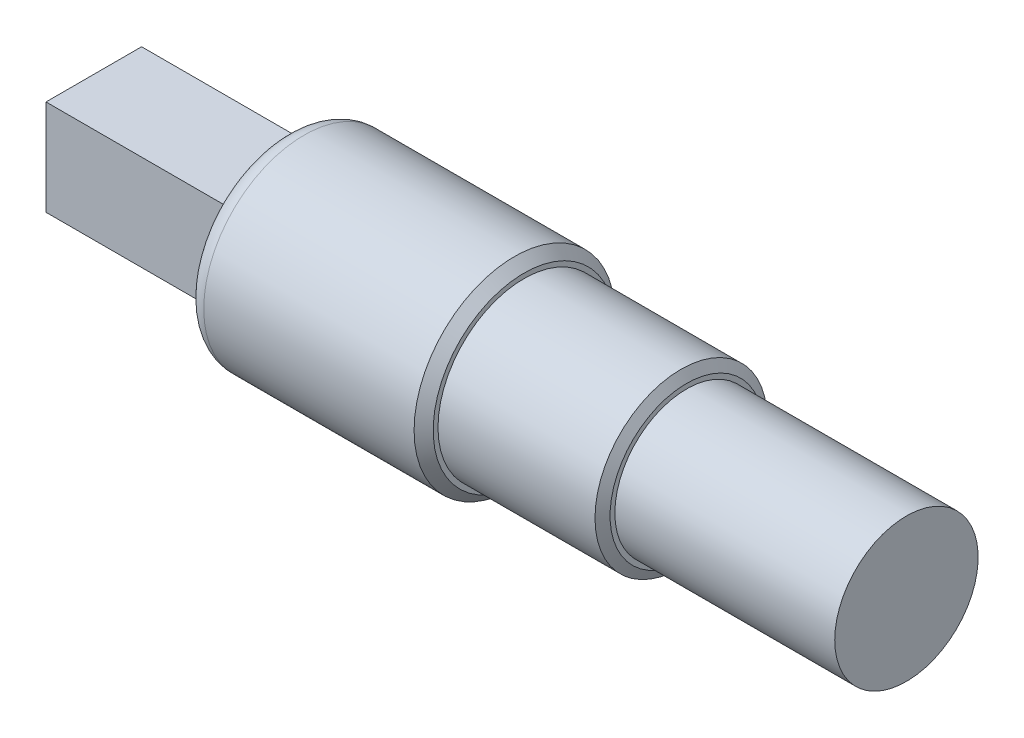
from build123d import *

# Parameters (mm, degrees)
SKETCH_2_W      = 10
SKETCH_2_H      = 10
EXTRUDE_1_DEPTH = 20
FILLET_1_R      = 2
CHAMFER_1_SIZE  = 1
CHAMFER_2_SIZE  = 1
CHAMFER_2_SIZE2 = 0.577350269


with BuildPart() as part:
    # Эскиз1 → Повернуть1 (revolve)
    with BuildSketch(Plane.XY, mode=Mode.PRIVATE) as revolve_1_sk:
        Polygon((0, 0), (0, -10.5), (25, -10.5), (25, -9), (42, -9), (42, -7.5), (65, -7.5), (65, 0), align=None)
    revolve(revolve_1_sk.sketch.rotate(Axis((0, 0, 0), (1, 0, 0)), 270), axis=Axis((0, 0, 0), (1, 0, 0)))

    # Эскиз2 → Бобышка-Вытянуть1 (add)
    with BuildSketch(Plane.ZY):
        Rectangle(SKETCH_2_W, SKETCH_2_H)
    extrude(amount=EXTRUDE_1_DEPTH)

    # Скругление1
    fillet_1_edges = [part.edges().sort_by_distance(p)[0] for p in [
        (0, 0, -10.5),
    ]]
    fillet(fillet_1_edges, radius=FILLET_1_R)

    # Фаска1
    chamfer_1_edges = [part.edges().sort_by_distance(p)[0] for p in [
        (25, 0, -10.5),
    ]]
    chamfer(chamfer_1_edges, length=CHAMFER_1_SIZE)

    # Фаска2
    chamfer_2_edges = [part.edges().sort_by_distance(p)[0] for p in [
        (42, 0, -9),
    ]]
    chamfer_2_side = [part.faces().sort_by_distance(p)[0] for p in [
        (42, 0, -8.745441559),
    ]]
    chamfer(chamfer_2_edges, length=CHAMFER_2_SIZE, length2=CHAMFER_2_SIZE2, reference=chamfer_2_side[0])


solid = part.part
